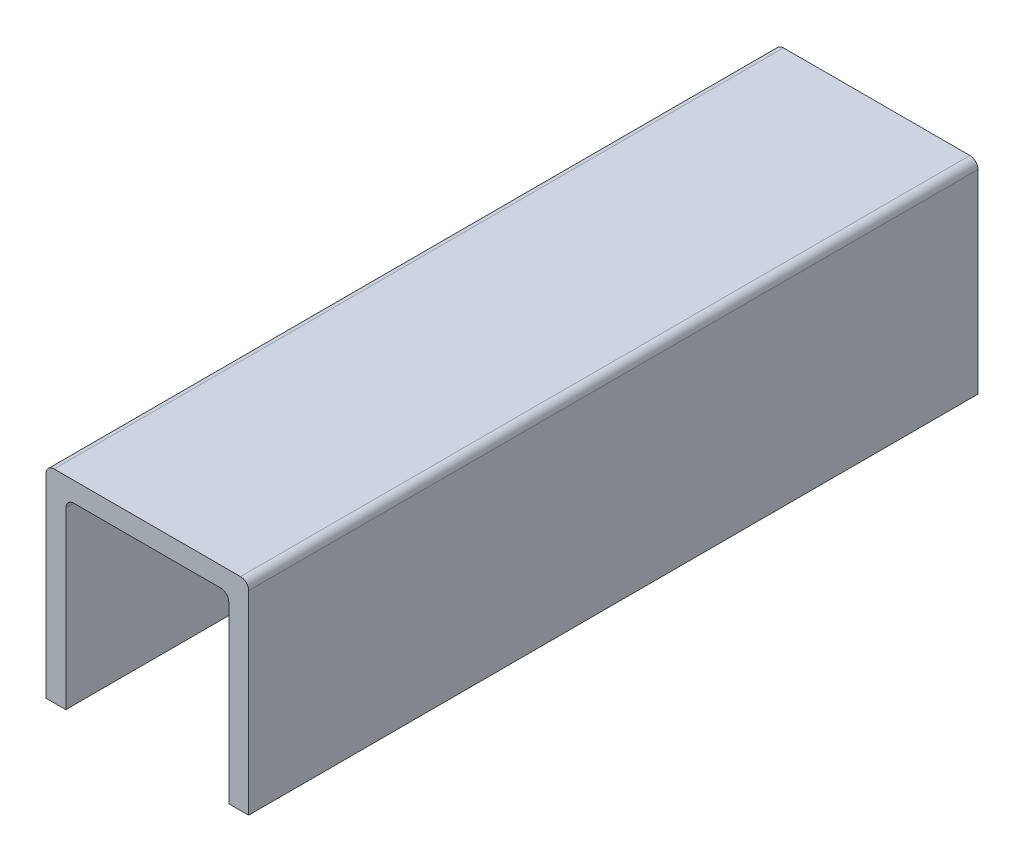
from build123d import *

# Parameters (mm, degrees)
BOSS_EXTRUDE1_DEPTH = 180
FILLET1_R           = 2


with BuildPart() as part:
    # Sketch1 → Boss-Extrude1 (new body)
    with BuildSketch(Plane.XY):
        Polygon((0, 0), (0, 50), (50, 50), (50, 0), (45.113, 0), (45.113, 45.113), (4.887, 45.113), (4.887, 0), align=None)
    extrude(amount=BOSS_EXTRUDE1_DEPTH)

    # Fillet1
    fillet1_edges = [part.edges().sort_by_distance(p)[0] for p in [
        (0, 50, 90),
        (50, 50, 90),
        (45.113, 45.113, 90),
        (4.887, 45.113, 90),
    ]]
    fillet(fillet1_edges, radius=FILLET1_R)


solid = part.part
